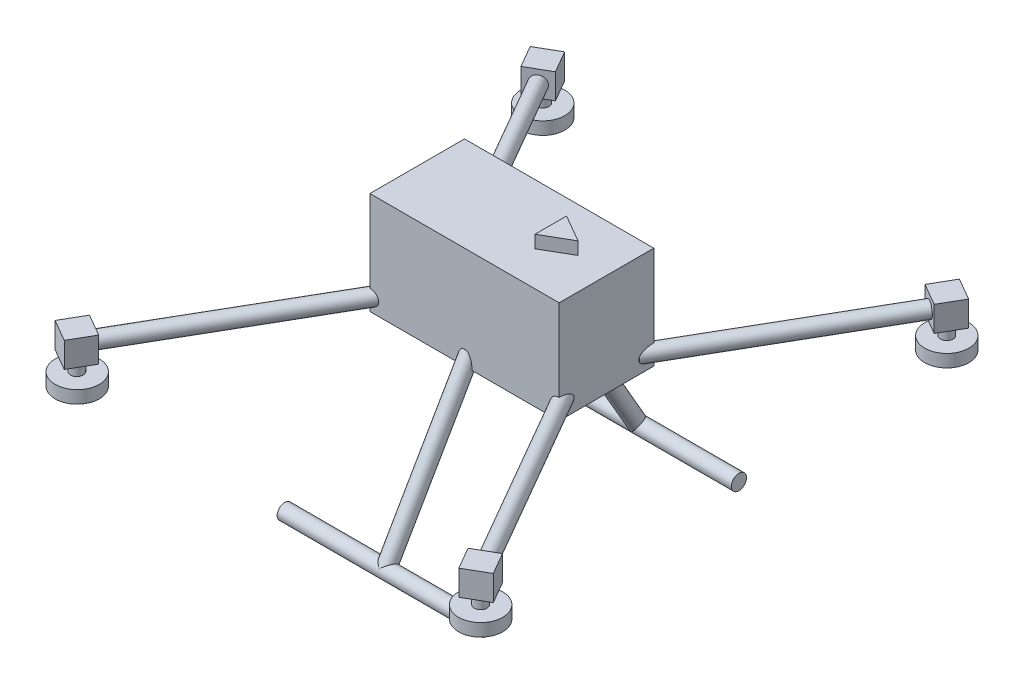
from build123d import *

# Parameters (mm, degrees)
SKETCH_9_W            = 300
SKETCH_9_H            = 150
EXTRUDE_2_DEPTH       = 162
EXTRUDE_3_DEPTH       = 340
EXTRUDE_3_DEPTH_BACK  = 20
SKETCH_10_R           = 12
EXTRUDE_4_DEPTH       = 338.918510241
EXTRUDE_4_DEPTH_BACK  = 20
SKETCH_11_R           = 12
EXTRUDE_5_DEPTH       = 340
EXTRUDE_5_DEPTH_BACK  = 20
SKETCH_13_R           = 12
EXTRUDE_6_DEPTH       = 340
EXTRUDE_6_DEPTH_BACK  = 20
SKETCH_12_R           = 12
EXTRUDE_7_DEPTH       = 20
EXTRUDE_7_DEPTH_BACK  = 20
SKETCH_14_W           = 40
SKETCH_14_H           = 40
EXTRUDE_8_DEPTH       = 20
EXTRUDE_8_DEPTH_BACK  = 20
SKETCH_17_W           = 40
SKETCH_17_H           = 40
EXTRUDE_9_DEPTH       = 20
EXTRUDE_9_DEPTH_BACK  = 20
SKETCH_18_W           = 40
SKETCH_18_H           = 40
EXTRUDE_10_DEPTH      = 20
EXTRUDE_10_DEPTH_BACK = 20
SKETCH_20_W           = 40
SKETCH_20_H           = 40
EXTRUDE_11_DEPTH      = 20
EXTRUDE_11_DEPTH_BACK = 20
SKETCH_21_R           = 10
SKETCH_22_R           = 35
EXTRUDE_12_DEPTH      = 20
EXTRUDE_13_DEPTH      = 250
EXTRUDE_13_DEPTH_BACK = 20
SKETCH_23_R           = 12
EXTRUDE_14_DEPTH      = 250
EXTRUDE_14_DEPTH_BACK = 20
SKETCH_24_R           = 12
EXTRUDE_15_DEPTH      = 20
EXTRUDE_15_DEPTH_BACK = 20
EXTRUDE_16_DEPTH      = 160
EXTRUDE_16_DEPTH_BACK = 160
SKETCH_29_R           = 12


with BuildPart() as part:
    # 草图9 → 凸台-拉伸2 (new body)
    with BuildSketch(Plane(origin=(0, 0, 0), x_dir=(1, 0, 0), z_dir=(0, 1, 0))):
        Rectangle(SKETCH_9_W, SKETCH_9_H)
    extrude(amount=EXTRUDE_2_DEPTH)

    # 草图10 → 凸台-拉伸3 (add, two sides: drawn at the far end of the back side and taken through both)
    with BuildSketch(Plane(origin=(-69.975952642, 0, 121.201905284), x_dir=(0, -1, 0), z_dir=(-0.500000000000001, 0, 0.866025403784438)).offset(-EXTRUDE_3_DEPTH_BACK)):
        with Locations(Location((-20, -92.403810568, 0), (0, 0, 90))):
            Circle(SKETCH_10_R)
    extrude(amount=EXTRUDE_3_DEPTH + EXTRUDE_3_DEPTH_BACK)

    # 草图11 → 凸台-拉伸4 (add, two sides: drawn at the far end of the back side and taken through both)
    with BuildSketch(Plane(origin=(-69.975952642, 0, -121.201905284), x_dir=(0, -1, 0), z_dir=(-0.5000000000000011, 0, -0.866025403784438)).offset(-EXTRUDE_4_DEPTH_BACK)):
        with Locations(Location((-20, 92.403810568, 0), (0, 0, 90))):
            Circle(SKETCH_11_R)
    extrude(amount=EXTRUDE_4_DEPTH + EXTRUDE_4_DEPTH_BACK)

    # 草图13 → 凸台-拉伸5 (add, two sides: drawn at the far end of the back side and taken through both)
    with BuildSketch(Plane(origin=(69.975952642, 0, 121.201905284), x_dir=(0, -1, 0), z_dir=(0.5000000000000011, 0, 0.866025403784438)).offset(-EXTRUDE_5_DEPTH_BACK)):
        with Locations(Location((-20, 92.403810568, 0), (0, 0, 90))):
            Circle(SKETCH_13_R)
    extrude(amount=EXTRUDE_5_DEPTH + EXTRUDE_5_DEPTH_BACK)

    # 草图12 → 凸台-拉伸6 (add, two sides: drawn at the far end of the back side and taken through both)
    with BuildSketch(Plane(origin=(69.975952642, 0, -121.201905284), x_dir=(0, -1, 0), z_dir=(0.5000000000000009, 0, -0.866025403784438)).offset(-EXTRUDE_6_DEPTH_BACK)):
        with Locations(Location((-20, -92.403810568, 0), (0, 0, 90))):
            Circle(SKETCH_12_R)
    extrude(amount=EXTRUDE_6_DEPTH + EXTRUDE_6_DEPTH_BACK)

    # 草图14 → 凸台-拉伸7 (add, two sides: drawn at the far end of the back side and taken through both)
    with BuildSketch(Plane(origin=(-239.975952642, 0, 415.650542571), x_dir=(0.8660254037844382, 0, 0.500000000000001), z_dir=(-0.500000000000001, 0, 0.8660254037844382)).offset(-EXTRUDE_7_DEPTH_BACK)):
        with Locations((-92.403810568, 20)):
            Rectangle(SKETCH_14_W, SKETCH_14_H)
    extrude(amount=EXTRUDE_7_DEPTH + EXTRUDE_7_DEPTH_BACK)

    # 草图17 → 凸台-拉伸8 (add, two sides: drawn at the far end of the back side and taken through both)
    with BuildSketch(Plane(origin=(-239.435207762, 0, -414.713944965), x_dir=(-0.866025403784438, 0, 0.5000000000000012), z_dir=(-0.5000000000000011, 0, -0.8660254037844379)).offset(-EXTRUDE_8_DEPTH_BACK)):
        with Locations((92.403810568, 20)):
            Rectangle(SKETCH_17_W, SKETCH_17_H)
    extrude(amount=EXTRUDE_8_DEPTH + EXTRUDE_8_DEPTH_BACK)

    # 草图18 → 凸台-拉伸9 (add, two sides: drawn at the far end of the back side and taken through both)
    with BuildSketch(Plane(origin=(239.975952642, 0, -415.650542571), x_dir=(-0.866025403784438, 0, -0.5000000000000012), z_dir=(0.5000000000000011, 0, -0.8660254037844379)).offset(-EXTRUDE_9_DEPTH_BACK)):
        with Locations((-92.403810568, 20)):
            Rectangle(SKETCH_18_W, SKETCH_18_H)
    extrude(amount=EXTRUDE_9_DEPTH + EXTRUDE_9_DEPTH_BACK)

    # 草图20 → 凸台-拉伸10 (add, two sides: drawn at the far end of the back side and taken through both)
    with BuildSketch(Plane(origin=(239.975952642, 0, 415.650542571), x_dir=(0.866025403784438, 0, -0.5000000000000012), z_dir=(0.5000000000000011, 0, 0.8660254037844379)).offset(-EXTRUDE_10_DEPTH_BACK)):
        with Locations((92.403810568, 20)):
            Rectangle(SKETCH_20_W, SKETCH_20_H)
    extrude(amount=EXTRUDE_10_DEPTH + EXTRUDE_10_DEPTH_BACK)

    # 草图21 → 凸台-拉伸11 (add, two sides: drawn at the far end of the back side and taken through both)
    with BuildSketch(Plane.XZ.offset(-EXTRUDE_11_DEPTH_BACK)):
        with Locations(Location((-320, 369.448637287, 0), (0, 0, 270))):
            Circle(SKETCH_21_R)
        with Locations(Location((-319.45925512, -368.512039681, 0), (0, 0, 270))):
            Circle(SKETCH_21_R)
        with Locations(Location((320, -369.448637287, 0), (0, 0, 270))):
            Circle(SKETCH_21_R)
        with Locations(Location((320, 369.448637287, 0), (0, 0, 270))):
            Circle(SKETCH_21_R)
    extrude(amount=EXTRUDE_11_DEPTH + EXTRUDE_11_DEPTH_BACK)

    # 草图22 → 凸台-拉伸12 (add)
    with BuildSketch(Plane.XZ.offset(20)):
        with Locations(Location((-319.45925512, -368.512039681, 0), (0, 0, 270))):
            Circle(SKETCH_22_R)
        with Locations(Location((320, -369.448637287, 0), (0, 0, 270))):
            Circle(SKETCH_22_R)
        with Locations(Location((320, 369.448637287, 0), (0, 0, 270))):
            Circle(SKETCH_22_R)
        with Locations(Location((-319.45925512, 369.448637287, 0), (0, 0, 270))):
            Circle(SKETCH_22_R)
    extrude(amount=EXTRUDE_12_DEPTH)

    # 草图23 → 凸台-拉伸13 (add, two sides: drawn at the far end of the back side and taken through both)
    with BuildSketch(Plane(origin=(0, -32.475952642, 18.75), x_dir=(1, 0, 0), z_dir=(0, -0.866025403784438, 0.500000000000001)).offset(-EXTRUDE_13_DEPTH_BACK)):
        with Locations(Location((0, 64.951905284, 0), (0, 0, 270))):
            Circle(SKETCH_23_R)
    extrude(amount=EXTRUDE_13_DEPTH + EXTRUDE_13_DEPTH_BACK)

    # 草图24 → 凸台-拉伸14 (add, two sides: drawn at the far end of the back side and taken through both)
    with BuildSketch(Plane(origin=(0, -32.475952642, -18.75), x_dir=(-1, 0, 0), z_dir=(0, -0.866025403784438, -0.500000000000001)).offset(-EXTRUDE_14_DEPTH_BACK)):
        with Locations(Location((0, 64.951905284, 0), (0, 0, 90))):
            Circle(SKETCH_24_R)
    extrude(amount=EXTRUDE_14_DEPTH + EXTRUDE_14_DEPTH_BACK)

    # 草图26 → 凸台-拉伸15 (add, two sides: drawn at the far end of the back side and taken through both)
    with BuildSketch(Plane(origin=(0, 162, 0), x_dir=(1, 0, 0), z_dir=(0, 1, 0)).offset(-EXTRUDE_15_DEPTH_BACK)):
        Polygon((100, 5.002088535), (56.698729811, 30.002088535), (56.698729811, -19.997911465), align=None)
    extrude(amount=EXTRUDE_15_DEPTH + EXTRUDE_15_DEPTH_BACK)

    # 草图29 → 凸台-拉伸16 (add, two sides: drawn at the far end of the back side and taken through both)
    with BuildSketch(Plane.ZY.offset(-EXTRUDE_16_DEPTH_BACK)):
        with Locations((-200, -216.506350946)):
            Circle(SKETCH_29_R)
        with Locations((200, -216.506350946)):
            Circle(SKETCH_29_R)
    extrude(amount=EXTRUDE_16_DEPTH + EXTRUDE_16_DEPTH_BACK)


solid = part.part
